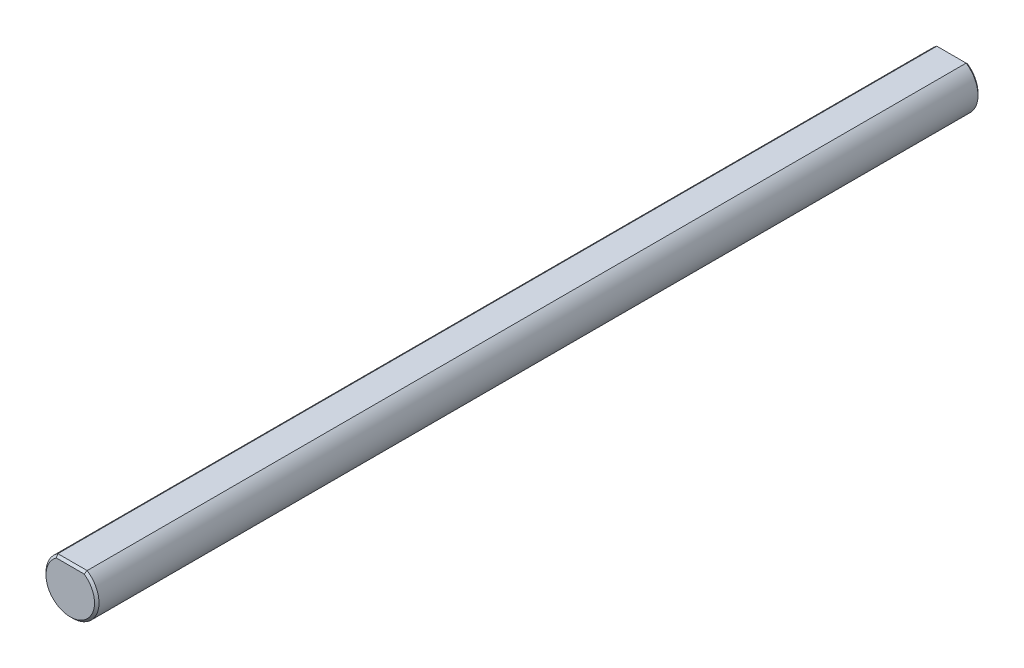
from build123d import *

# Parameters (mm, degrees)
BOSS_EXTRUDE1_DEPTH = 100
CHAMFER1_SIZE       = 0.254


with BuildPart() as part:
    # Sketch1 → Boss-Extrude1 (new body)
    with BuildSketch(Plane.XY.offset(100)):
        with BuildLine():
            Line((1.658312395, 2.5), (-1.658312395, 2.5))
            ThreePointArc((-1.658312395, 2.5), (0, -3), (1.658312395, 2.5))
        make_face()
    extrude(amount=-BOSS_EXTRUDE1_DEPTH)

    # Chamfer1
    chamfer1_edges = [part.edges().sort_by_distance(p)[0] for p in [
        (0, 2.5, 100),
        (0, -3, 100),
        (0, -3, 0),
        (0, 2.5, 0),
    ]]
    chamfer(chamfer1_edges, length=CHAMFER1_SIZE)


solid = part.part
